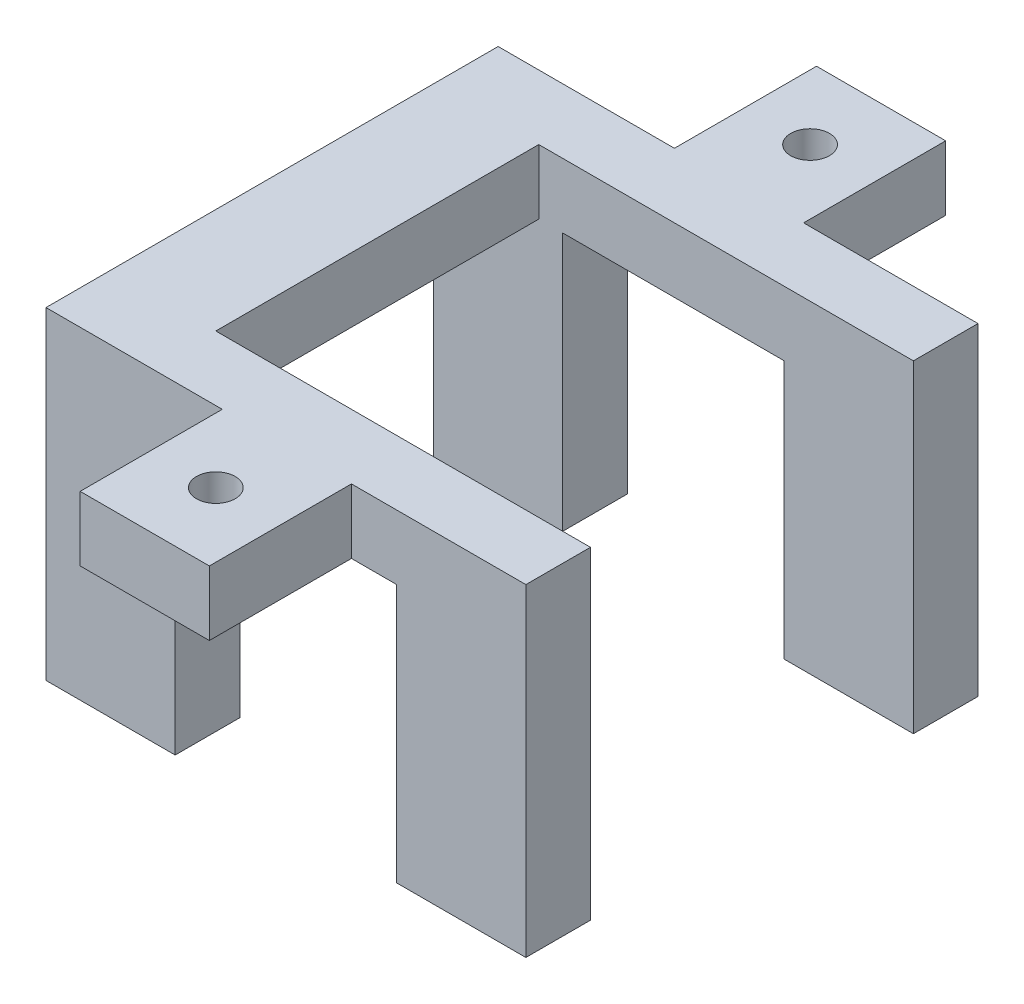
from build123d import *

# Parameters (mm, degrees)
BOSS_EXTRUDE1_DEPTH              = 5
SKETCH3_W                        = 11
SKETCH3_H                        = 5
BOSS_EXTRUDE2_DEPTH              = 5
SKETCH4_W                        = 5
SKETCH4_H                        = 5
BOSS_EXTRUDE3_DEPTH              = 21
SKETCH5_W                        = 10
SKETCH5_H                        = 5
BOSS_EXTRUDE4_DEPTH              = 20
SKETCH6_W                        = 11
SKETCH6_H                        = 5
BOSS_EXTRUDE5_DEPTH              = 5
SKETCH7_W                        = 5
SKETCH7_H                        = 5
BOSS_EXTRUDE6_DEPTH              = 21
SKETCH8_W                        = 10
SKETCH8_H                        = 5
BOSS_EXTRUDE7_DEPTH              = 20
SKETCH11_W                       = 10
SKETCH11_H                       = 5
BOSS_EXTRUDE8_DEPTH              = 3.5
SKETCH12_W                       = 10
SKETCH12_H                       = 5
BOSS_EXTRUDE9_DEPTH              = 3.5
CUT_EXTRUDE6_DEPTH               = 14.5
CUT_EXTRUDE8_DEPTH               = 41.078048855
CUT_EXTRUDE8_DEPTH_BACK          = 14.5
SKETCH17_W                       = 1.38
SKETCH17_H                       = 3.56
CUT_EXTRUDE9_DEPTH               = 14.5
CUT_EXTRUDE10_DEPTH              = 14.5
SKETCH_1_W                       = 8
SKETCH_1_H                       = 25
EXTRUDE_1_DEPTH                  = 5
SKETCH_2_W                       = 8
SKETCH_2_H                       = 25
EXTRUDE_2_DEPTH                  = 5
AUFSATZ_LINEAR_AUSTRAGEN1_DEPTH  = 4
SKIZZE3_W                        = 10
SKIZZE3_H                        = 5
SCHNITT_LINEAR_AUSTRAGEN2_DEPTH  = 3.5
SCHNITT_LINEAR_AUSTRAGEN3_DEPTH  = 4
AUFSATZ_LINEAR_AUSTRAGEN3_DEPTH  = 11
SKIZZE7_R                        = 1.5
SCHNITT_LINEAR_AUSTRAGEN6_DEPTH  = 10
SKIZZE8_W                        = 10
SKIZZE8_H                        = 5
SCHNITT_LINEAR_AUSTRAGEN8_DEPTH  = 4
AUFSATZ_LINEAR_AUSTRAGEN4_DEPTH  = 4
SCHNITT_LINEAR_AUSTRAGEN9_DEPTH  = 4
AUFSATZ_LINEAR_AUSTRAGEN6_DEPTH  = 11
SKIZZE12_R                       = 1.5
SCHNITT_LINEAR_AUSTRAGEN10_DEPTH = 11
SKIZZE15_W                       = 8
SKIZZE15_H                       = 20
SCHNITT_LINEAR_AUSTRAGEN11_DEPTH = 37
AUFSATZ_LINEAR_AUSTRAGEN7_DEPTH  = 20
AUFSATZ_LINEAR_AUSTRAGEN8_DEPTH  = 20
SKIZZE18_W                       = 2.855193512
SKIZZE18_H                       = 5
SCHNITT_LINEAR_AUSTRAGEN12_DEPTH = 35


with BuildPart() as part:
    # Sketch1 → Boss-Extrude1 (new body)
    with BuildSketch(Plane(origin=(0, 0, 0), x_dir=(1, 0, 0), z_dir=(0, 1, 0))):
        Polygon((5.5, 3), (5.5, 0), (5.5, -3), (5.5, -8.5), (0, -8.5), (-5.5, -8.5), (-5.5, -3), (-5.5, 8.5), (0, 8.5), (5.5, 8.5), align=None)
    extrude(amount=BOSS_EXTRUDE1_DEPTH)

    # Sketch3 → Boss-Extrude2 (add)
    with BuildSketch(Plane.XY.offset(8.5)):
        with Locations((0, 2.5)):
            Rectangle(SKETCH3_W, SKETCH3_H)
    extrude(amount=BOSS_EXTRUDE2_DEPTH)

    # Sketch4 → Boss-Extrude3 (add)
    with BuildSketch(Plane(origin=(5.5, 0, 0), x_dir=(0, 0, -1), z_dir=(1, 0, 0))):
        with Locations((-11, 2.5)):
            Rectangle(SKETCH4_W, SKETCH4_H)
    extrude(amount=BOSS_EXTRUDE3_DEPTH)

    # Sketch5 → Boss-Extrude4 (add)
    with BuildSketch(Plane.XZ):
        with Locations((21.5, 11)):
            Rectangle(SKETCH5_W, SKETCH5_H)
    extrude(amount=BOSS_EXTRUDE4_DEPTH)

    # Sketch6 → Boss-Extrude5 (add)
    with BuildSketch(Plane(origin=(0, 0, -8.5), x_dir=(-1, 0, 0), z_dir=(0, 0, -1))):
        with Locations((0, 2.5)):
            Rectangle(SKETCH6_W, SKETCH6_H)
    extrude(amount=BOSS_EXTRUDE5_DEPTH)

    # Sketch7 → Boss-Extrude6 (add)
    with BuildSketch(Plane(origin=(5.5, 0, 0), x_dir=(0, 0, -1), z_dir=(1, 0, 0))):
        with Locations((11, 2.5)):
            Rectangle(SKETCH7_W, SKETCH7_H)
    extrude(amount=BOSS_EXTRUDE6_DEPTH)

    # Sketch8 → Boss-Extrude7 (add)
    with BuildSketch(Plane(origin=(0, 0, 0), x_dir=(-1, 0, 0), z_dir=(0, -1, 0))):
        with Locations((-21.5, 11)):
            Rectangle(SKETCH8_W, SKETCH8_H)
    extrude(amount=BOSS_EXTRUDE7_DEPTH)

    # Sketch11 → Boss-Extrude8 (add)
    with BuildSketch(Plane(origin=(0, 0, 8.5), x_dir=(-1, 0, 0), z_dir=(0, 0, -1))):
        with Locations((-21.5, -12.5)):
            Rectangle(SKETCH11_W, SKETCH11_H)
    extrude(amount=BOSS_EXTRUDE8_DEPTH)

    # Sketch12 → Boss-Extrude9 (add)
    with BuildSketch(Plane.XY.offset(-8.5)):
        with Locations((21.5, -12.5)):
            Rectangle(SKETCH12_W, SKETCH12_H)
    extrude(amount=BOSS_EXTRUDE9_DEPTH)

    # Sketch14 → Cut-Extrude6 (cut)
    with BuildSketch(Plane(origin=(26.5, 0, 0), x_dir=(0, 0, -1), z_dir=(1, 0, 0))):
        Polygon((-6.379568334, -12.879568334), (-6.379568334, -15), (-5, -15), (-5, -11.439784167), (-6.379568334, -11.439784167), align=None)
    extrude(amount=-CUT_EXTRUDE6_DEPTH, mode=Mode.SUBTRACT)

    # Sketch16 → Cut-Extrude8 (cut, two sides: drawn at the far end of the back side and taken through both)
    with BuildSketch(Plane(origin=(26.5, 0, 0), x_dir=(0, 0, -1), z_dir=(1, 0, 0)).offset(-CUT_EXTRUDE8_DEPTH_BACK)):
        Polygon((-6.379568334, -13), (-8.5, -15), (-7.439784167, -15), (-6.379568334, -15), align=None)
    extrude(amount=CUT_EXTRUDE8_DEPTH + CUT_EXTRUDE8_DEPTH_BACK, mode=Mode.SUBTRACT)

    # Sketch17 → Cut-Extrude9 (cut)
    with BuildSketch(Plane(origin=(26.5, 0, 0), x_dir=(0, 0, -1), z_dir=(1, 0, 0))):
        with Locations((5.69, -13.22)):
            Rectangle(SKETCH17_W, SKETCH17_H)
    extrude(amount=-CUT_EXTRUDE9_DEPTH, mode=Mode.SUBTRACT)

    # Sketch18 → Cut-Extrude10 (cut)
    with BuildSketch(Plane(origin=(26.5, 0, 0), x_dir=(0, 0, -1), z_dir=(1, 0, 0))):
        Polygon((6.38, -13), (6.38, -15), (8.5, -15), align=None)
    extrude(amount=-CUT_EXTRUDE10_DEPTH, mode=Mode.SUBTRACT)

    # 草图1 → 凸台-拉伸1 (add)
    with BuildSketch(Plane.XY.offset(13.5)):
        with Locations((30.5, -7.5)):
            Rectangle(SKETCH_1_W, SKETCH_1_H)
    extrude(amount=-EXTRUDE_1_DEPTH)

    # 草图2 → 凸台-拉伸2 (add)
    with BuildSketch(Plane(origin=(0, 0, -13.5), x_dir=(-1, 0, 0), z_dir=(0, 0, -1))):
        with Locations((-30.5, -7.5)):
            Rectangle(SKETCH_2_W, SKETCH_2_H)
    extrude(amount=-EXTRUDE_2_DEPTH)

    # Skizze2 → Aufsatz-Linear austragen1 (add)
    with BuildSketch(Plane.XY.offset(13.5)):
        Polygon((-5.5, 5), (-5.5, 0), (16.5, 0), (16.5, -20), (34.5, -20), (34.5, 5), align=None)
    extrude(amount=AUFSATZ_LINEAR_AUSTRAGEN1_DEPTH)

    # Skizze3 → Schnitt-Linear austragen2 (cut)
    with BuildSketch(Plane(origin=(0, 0, 5), x_dir=(-1, 0, 0), z_dir=(0, 0, -1))):
        with Locations((-21.5, -12.5)):
            Rectangle(SKIZZE3_W, SKIZZE3_H)
    extrude(amount=-SCHNITT_LINEAR_AUSTRAGEN2_DEPTH, mode=Mode.SUBTRACT)

    # Skizze4 → Schnitt-Linear austragen3 (cut)
    with BuildSketch(Plane(origin=(0, 0, 8.5), x_dir=(-1, 0, 0), z_dir=(0, 0, -1))):
        Polygon((-34.5, 5), (-34.5, -20), (-16.5, -20), (-16.5, 0), (-5.5, 0), (-5.5, 5), align=None)
    extrude(amount=-SCHNITT_LINEAR_AUSTRAGEN3_DEPTH, mode=Mode.SUBTRACT)

    # Skizze6 → Aufsatz-Linear austragen3 (add)
    with BuildSketch(Plane.XY.offset(17.5)):
        Polygon((16, 5), (11, 5), (11, 0), (16.5, 0), (21, 0), (21, 5), align=None)
    extrude(amount=AUFSATZ_LINEAR_AUSTRAGEN3_DEPTH)

    # Skizze7 → Schnitt-Linear austragen6 (cut)
    with BuildSketch(Plane(origin=(0, 5, 0), x_dir=(1, 0, 0), z_dir=(0, 1, 0))):
        with Locations(Location((16, -23, 0), (0, 0, 270))):
            Circle(SKIZZE7_R)
    extrude(amount=-SCHNITT_LINEAR_AUSTRAGEN6_DEPTH, mode=Mode.SUBTRACT)

    # Skizze8 → Schnitt-Linear austragen8 (cut)
    with BuildSketch(Plane.XY.offset(-8.5)):
        with Locations((21.5, -12.5)):
            Rectangle(SKIZZE8_W, SKIZZE8_H)
    extrude(amount=SCHNITT_LINEAR_AUSTRAGEN8_DEPTH, mode=Mode.SUBTRACT)

    # Skizze9 → Aufsatz-Linear austragen4 (add)
    with BuildSketch(Plane(origin=(0, 0, -13.5), x_dir=(-1, 0, 0), z_dir=(0, 0, -1))):
        Polygon((-34.5, 5), (-34.5, -20), (-16.5, -20), (-16.5, 0), (5.5, 0), (5.5, 5), align=None)
    extrude(amount=AUFSATZ_LINEAR_AUSTRAGEN4_DEPTH)

    # Skizze10 → Schnitt-Linear austragen9 (cut)
    with BuildSketch(Plane.XY.offset(-8.5)):
        Polygon((5.5, 5), (5.5, 0), (16.5, 0), (16.5, -20), (34.5, -20), (34.5, 5), align=None)
    extrude(amount=-SCHNITT_LINEAR_AUSTRAGEN9_DEPTH, mode=Mode.SUBTRACT)

    # Skizze11 → Aufsatz-Linear austragen6 (add)
    with BuildSketch(Plane(origin=(0, 0, -17.5), x_dir=(-1, 0, 0), z_dir=(0, 0, -1))):
        Polygon((-11, 0), (-11, 5), (-21, 5), (-21, 0), (-16.5, 0), align=None)
    extrude(amount=AUFSATZ_LINEAR_AUSTRAGEN6_DEPTH)

    # Skizze12 → Schnitt-Linear austragen10 (cut)
    with BuildSketch(Plane(origin=(0, 5, 0), x_dir=(1, 0, 0), z_dir=(0, 1, 0))):
        with Locations(Location((16, 23, 0), (0, 0, 270))):
            Circle(SKIZZE12_R)
    extrude(amount=-SCHNITT_LINEAR_AUSTRAGEN10_DEPTH, mode=Mode.SUBTRACT)

    # Skizze15 → Schnitt-Linear austragen11 (cut)
    with BuildSketch(Plane.XY.offset(17.5)):
        with Locations((20.5, -10)):
            Rectangle(SKIZZE15_W, SKIZZE15_H)
    extrude(amount=-SCHNITT_LINEAR_AUSTRAGEN11_DEPTH, mode=Mode.SUBTRACT)

    # Skizze16 → Aufsatz-Linear austragen7 (add)
    with BuildSketch(Plane.XZ):
        Polygon((7.355193512, 12.5), (7.355193512, 17.5), (-2.644806488, 17.5), (-2.644806488, 12.5), (5.5, 12.5), align=None)
    extrude(amount=AUFSATZ_LINEAR_AUSTRAGEN7_DEPTH)

    # Skizze17 → Aufsatz-Linear austragen8 (add)
    with BuildSketch(Plane.XZ):
        Polygon((5.5, -12.5), (-2.644806488, -12.5), (-2.644806488, -17.5), (7.355193512, -17.5), (7.355193512, -12.5), align=None)
    extrude(amount=AUFSATZ_LINEAR_AUSTRAGEN8_DEPTH)

    # Skizze18 → Schnitt-Linear austragen12 (cut)
    with BuildSketch(Plane(origin=(0, 0, -17.5), x_dir=(-1, 0, 0), z_dir=(0, 0, -1))):
        with Locations((4.072403244, 2.5)):
            Rectangle(SKIZZE18_W, SKIZZE18_H)
    extrude(amount=-SCHNITT_LINEAR_AUSTRAGEN12_DEPTH, mode=Mode.SUBTRACT)


solid = part.part
